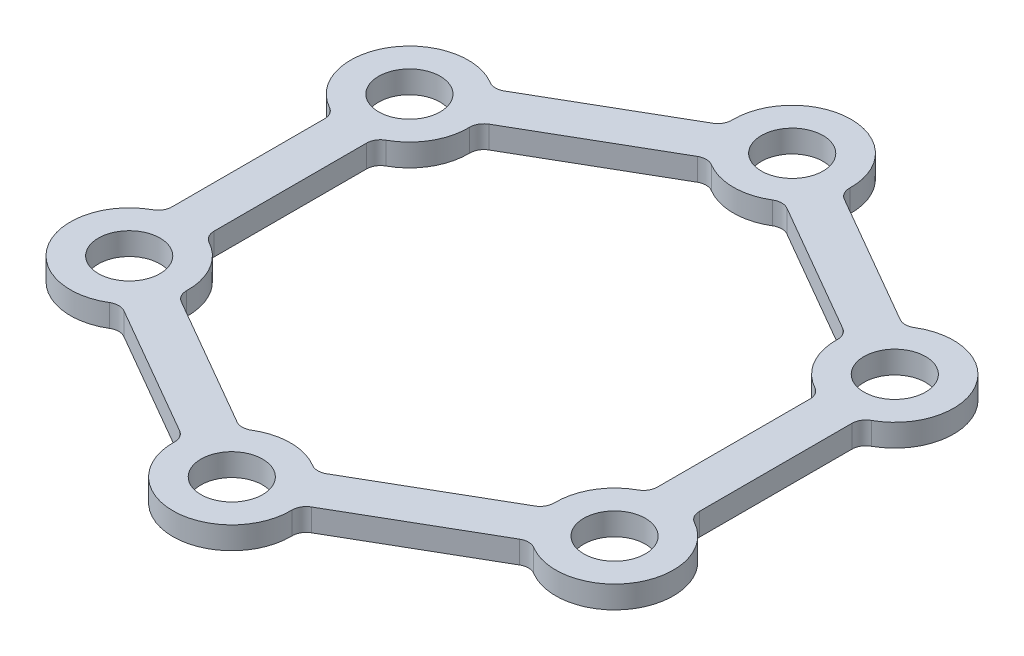
from build123d import *

# Parameters (mm, degrees)
SKETCH2_R           = 1.1
BOSS_EXTRUDE1_DEPTH = 0.8
CIRPATTERN1_COUNT   = 6
FILLET1_R           = 0.5


with BuildPart() as part:
    # Sketch2 → Boss-Extrude1 (new body)
    with BuildSketch(Plane(origin=(0, 0, 0), x_dir=(1, 0, 0), z_dir=(0, 1, 0))):
        with BuildLine():
            Line((7.33654129, 6.630271315), (2.073712748, 9.668766791))
            ThreePointArc((2.073712748, 9.668766791), (-1.818653348, 11.05), (1.323712748, 8.369728685))
            Line((1.323712748, 8.369728685), (6.58654129, 5.331233209))
            ThreePointArc((6.58654129, 5.331233209), (6.84160069, 6.05), (7.33654129, 6.630271315))
        make_face()
        with Locations((0, 10)):
            Circle(SKETCH2_R, mode=Mode.SUBTRACT)
    boss_extrude1 = extrude(amount=BOSS_EXTRUDE1_DEPTH)

    # CirPattern1: Boss-Extrude1 ×6 about axis
    cirpattern1_axis = Axis((0, 0.8, 0), (0, -1, 0))
    for i in range(1, CIRPATTERN1_COUNT):
        add(boss_extrude1.rotate(cirpattern1_axis, i * 360 / CIRPATTERN1_COUNT))

    # Fillet1
    fillet1_edges = [part.edges().sort_by_distance(p)[0] for p in [
        (1.323712748, 0.4, -8.369728685),
        (-1.323712748, 0.4, -8.369728685),
        (-6.58654129, 0.4, -5.331233209),
        (-7.910254038, 0.4, -3.038495475),
        (-7.910254038, 0.4, 3.038495475),
        (-6.58654129, 0.4, 5.331233209),
        (-1.323712748, 0.4, 8.369728685),
        (1.323712748, 0.4, 8.369728685),
        (6.58654129, 0.4, 5.331233209),
        (7.910254038, 0.4, 3.038495475),
        (7.910254038, 0.4, -3.038495475),
        (6.58654129, 0.4, -5.331233209),
        (9.410254038, 0.4, -3.038495475),
        (9.410254038, 0.4, 3.038495475),
        (7.33654129, 0.4, 6.630271315),
        (2.073712748, 0.4, 9.668766791),
        (-2.073712748, 0.4, 9.668766791),
        (-9.410254038, 0.4, 3.038495475),
        (-9.410254038, 0.4, -3.038495475),
        (-7.33654129, 0.4, -6.630271315),
        (-2.073712748, 0.4, -9.668766791),
        (2.073712748, 0.4, -9.668766791),
        (7.33654129, 0.4, -6.630271315),
        (-7.33654129, 0.4, 6.630271315),
    ]]
    fillet(fillet1_edges, radius=FILLET1_R)


solid = part.part
